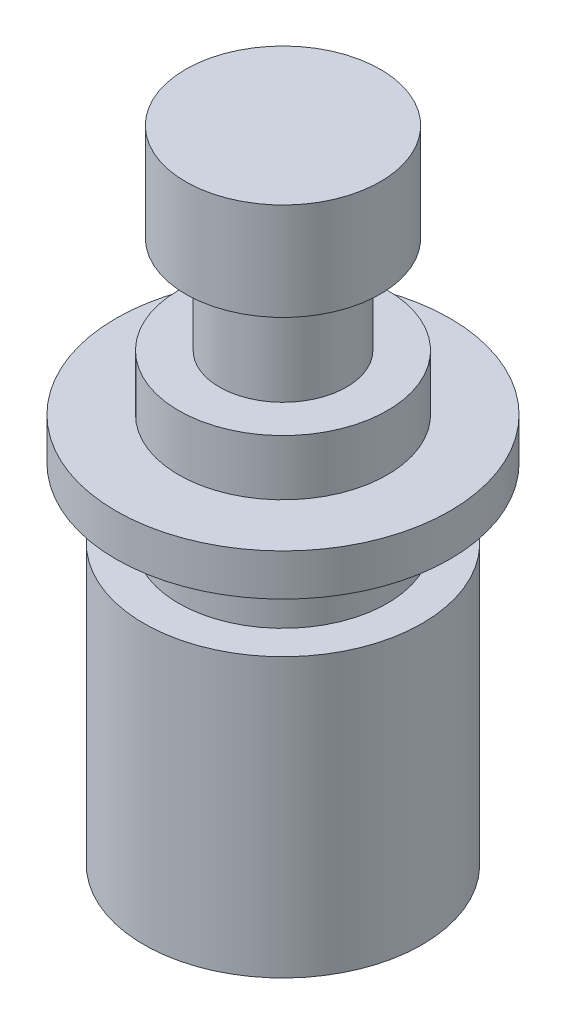
from build123d import *


with BuildPart() as part:
    # Esquisse1 → Révolution1 (revolve)
    with BuildSketch(Plane.XY, mode=Mode.PRIVATE) as r_volution1_sk:
        Polygon((0, -72.517220377), (3.5, -72.517220377), (3.5, -76.017220377), (2.2857838, -76.017220377), (2.2857838, -79.517220377), (3.75, -79.517220377), (3.75, -81.517220377), (6, -81.517220377), (6, -83.017220377), (3.75, -83.017220377), (3.75, -85.517220377), (5, -85.517220377), (5, -95.517220377), (0, -95.517220377), align=None)
    revolve(r_volution1_sk.sketch.rotate(Axis((0, -72.517220377, 0), (0, -1, 0)), 180), axis=Axis((0, -72.517220377, 0), (0, -1, 0)))


solid = part.part
